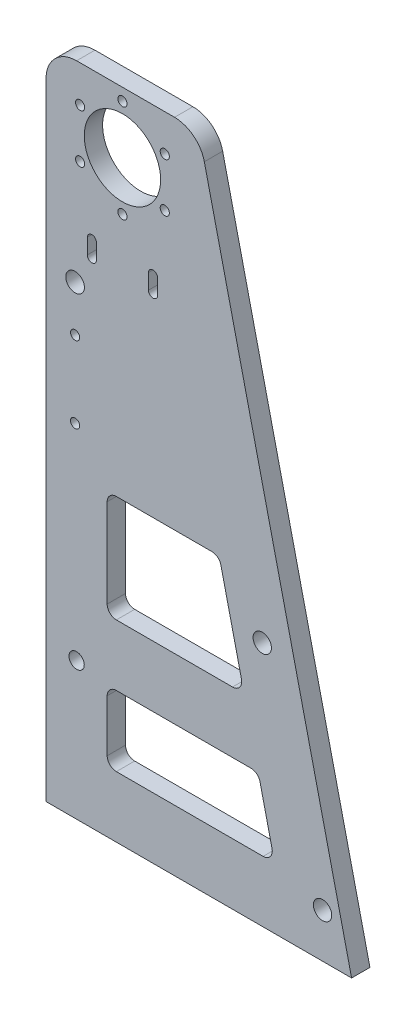
from build123d import *

# Parameters (mm, degrees)
ESBO_O1_R                = 12.5
ESBO_O1_R_2              = 1.5
ESBO_O1_R_3              = 2.5
RESSALTO_EXTRUS_O2_DEPTH = 6
FILETE1_R                = 10
ESBO_O2_R                = 1.5
ESBO_O2_R_2              = 3
ESBO_O2_R_3              = 3.05
CORTE_EXTRUS_O1_DEPTH    = 238.194013415
ESBO_O3_R                = 3
CORTE_EXTRUS_O2_DEPTH    = 238.194013415


with BuildPart() as part:
    # Esboço1 → Ressalto-extrusão2 (new body)
    with BuildSketch(Plane.XY):
        Polygon((0, 0), (0, 215), (50, 215), (100, 0), align=None)
        with Locations((25, 195)):
            Circle(ESBO_O1_R, mode=Mode.SUBTRACT)
        with Locations((25, 211)):
            Circle(ESBO_O1_R_2, mode=Mode.SUBTRACT)
        with Locations((38.856406461, 203)):
            Circle(ESBO_O1_R_2, mode=Mode.SUBTRACT)
        with Locations((38.856406461, 187)):
            Circle(ESBO_O1_R_2, mode=Mode.SUBTRACT)
        with Locations((25, 179)):
            Circle(ESBO_O1_R_2, mode=Mode.SUBTRACT)
        with Locations((11.143593539, 187)):
            Circle(ESBO_O1_R_2, mode=Mode.SUBTRACT)
        with Locations((11.143593539, 203)):
            Circle(ESBO_O1_R_2, mode=Mode.SUBTRACT)
        with Locations((10, 45)):
            Circle(ESBO_O1_R_3, mode=Mode.SUBTRACT)
        with BuildLine():
            Line((20, 95), (20, 66))
            ThreePointArc((20, 66), (20.878679656, 63.878679656), (23, 63))
            Line((23, 63), (61.03739436, 63))
            ThreePointArc((61.03739436, 63), (63.386715693, 64.134339454), (63.959418441, 66.679540484))
            Line((63.959418441, 66.679540484), (57.215232395, 95.679540484))
            ThreePointArc((57.215232395, 95.679540484), (56.15886886, 97.349321333), (54.293208314, 98))
            Line((54.293208314, 98), (23, 98))
            ThreePointArc((23, 98), (20.878679656, 97.121320344), (20, 95))
        make_face(mode=Mode.SUBTRACT)
        with BuildLine():
            Line((20, 40), (20, 23))
            ThreePointArc((20, 23), (20.878679656, 20.878679656), (23, 20))
            Line((23, 20), (71.03739436, 20))
            ThreePointArc((71.03739436, 20), (73.386715693, 21.134339454), (73.959418441, 23.679540484))
            Line((73.959418441, 23.679540484), (70.005930069, 40.679540484))
            ThreePointArc((70.005930069, 40.679540484), (68.949566534, 42.349321333), (67.083905988, 43))
            Line((67.083905988, 43), (23, 43))
            ThreePointArc((23, 43), (20.878679656, 42.121320344), (20, 40))
        make_face(mode=Mode.SUBTRACT)
    extrude(amount=RESSALTO_EXTRUS_O2_DEPTH)

    # Filete1
    filete1_edges = [part.edges().sort_by_distance(p)[0] for p in [
        (0, 215, 3),
        (50, 215, 3),
    ]]
    fillet(filete1_edges, radius=FILETE1_R)

    # Esboço2 → Corte-extrusão1 (cut, through all)
    with BuildSketch(Plane.XY.offset(6)):
        with Locations((9.5, 137)):
            Circle(ESBO_O2_R)
        with Locations((90.5, 14.5)):
            Circle(ESBO_O2_R_2)
        with Locations((9.5, 112)):
            Circle(ESBO_O2_R)
        with Locations((9.5, 152)):
            Circle(ESBO_O2_R_3)
        with BuildLine():
            Line((13.5, 161.71), (13.5, 166.71))
            ThreePointArc((13.5, 166.71), (15, 168.21), (16.5, 166.71))
            Line((16.5, 166.71), (16.5, 161.71))
            ThreePointArc((16.5, 161.71), (15, 160.21), (13.5, 161.71))
        make_face()
        with BuildLine():
            Line((33.5, 161.71), (33.5, 166.71))
            ThreePointArc((33.5, 166.71), (35, 168.21), (36.5, 166.71))
            Line((36.5, 166.71), (36.5, 161.71))
            ThreePointArc((36.5, 161.71), (35, 160.21), (33.5, 161.71))
        make_face()
    extrude(amount=-CORTE_EXTRUS_O1_DEPTH, mode=Mode.SUBTRACT)

    # Esboço3 → Corte-extrusão2 (cut, through all)
    with BuildSketch(Plane.XY.offset(6)):
        with Locations((70.759810426, 80.398555206)):
            Circle(ESBO_O3_R)
    extrude(amount=-CORTE_EXTRUS_O2_DEPTH, mode=Mode.SUBTRACT)


solid = part.part
